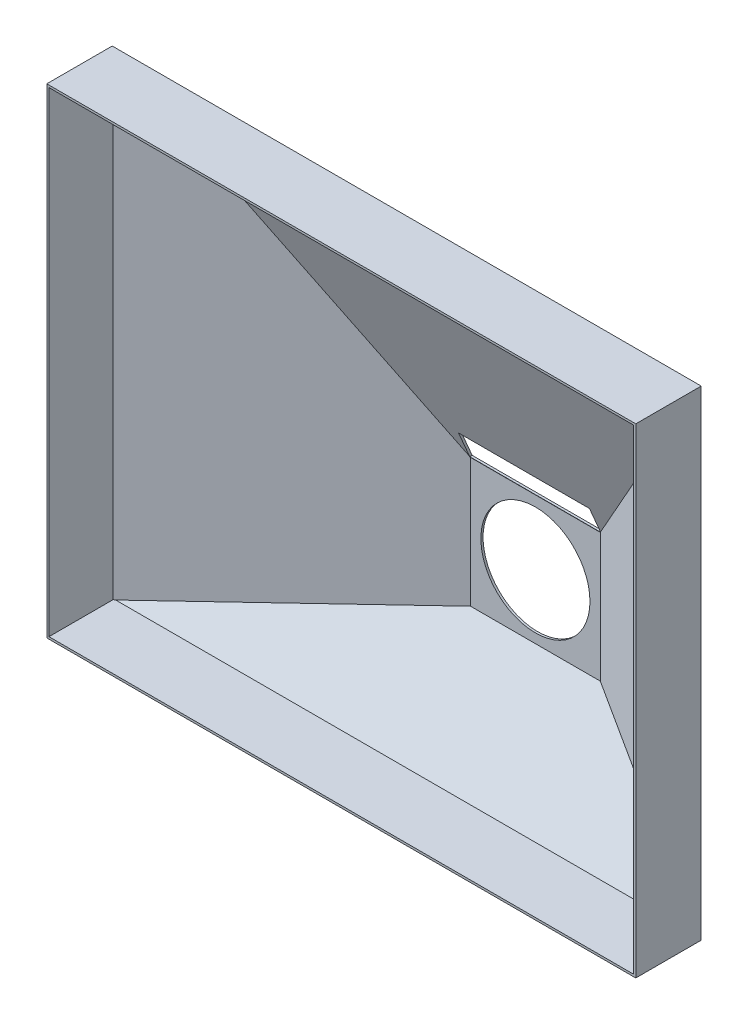
from build123d import *

# Parameters (mm, degrees)
EXTRUDE_1_REACH     = 237
SKETCH_7_W          = 270
SKETCH_7_H          = 220
SHELL_1_T           = -1
SKETCH_8_R          = 25
CUT_EXTRUDE_2_DEPTH = 10
SKETCH_9_W          = 60
SKETCH_9_H          = 12
CUT_EXTRUDE_3_DEPTH = 10


with BuildPart() as part:
    # 草图2 → 放样1 section 0
    with BuildSketch(Plane.XY.offset(60)):
        with BuildLine():
            Line((-135, 170), (135, 170))
            Line((135, 170), (135, -50))
            Line((135, -50), (-135, -50))
            Line((-135, -50), (-135, 170))
        make_face()
    # 草图1 → 放样1 section 1
    with BuildSketch(Plane.XY):
        with BuildLine():
            Line((-30, 30), (30, 30))
            Line((30, 30), (30, -30))
            Line((30, -30), (-30, -30))
            Line((-30, -30), (-30, 30))
        make_face()
    loft()

    # 草图7 → 凸台-拉伸1 (add, up to next)
    with BuildSketch(Plane.XY.offset(90), mode=Mode.PRIVATE) as extrude_1_sk1:
        with Locations((0, 60)):
            Rectangle(SKETCH_7_W, SKETCH_7_H)
    extrude_1_tool1 = extrude(extrude_1_sk1.sketch, amount=-EXTRUDE_1_REACH, mode=Mode.PRIVATE) - part.part
    add(extrude_1_tool1.solids().sort_by_distance((0, 60, 90))[0])

    # 抽壳1
    shell_1_openings = [part.faces().sort_by_distance(p)[0] for p in [
        (0, 60, 90),
    ]]
    offset(amount=SHELL_1_T, openings=shell_1_openings)

    # 草图8 → 切除-拉伸2 (cut)
    with BuildSketch(Plane.XY.offset(1)):
        Circle(SKETCH_8_R)
    extrude(amount=-CUT_EXTRUDE_2_DEPTH, mode=Mode.SUBTRACT)

    # 草图9 → 切除-拉伸3 (cut)
    with BuildSketch(Plane(origin=(0, 0, 0), x_dir=(-1, 0, 0), z_dir=(0, 0, -1))):
        with Locations((0, 36)):
            Rectangle(SKETCH_9_W, SKETCH_9_H)
    extrude(amount=-CUT_EXTRUDE_3_DEPTH, mode=Mode.SUBTRACT)


solid = part.part
